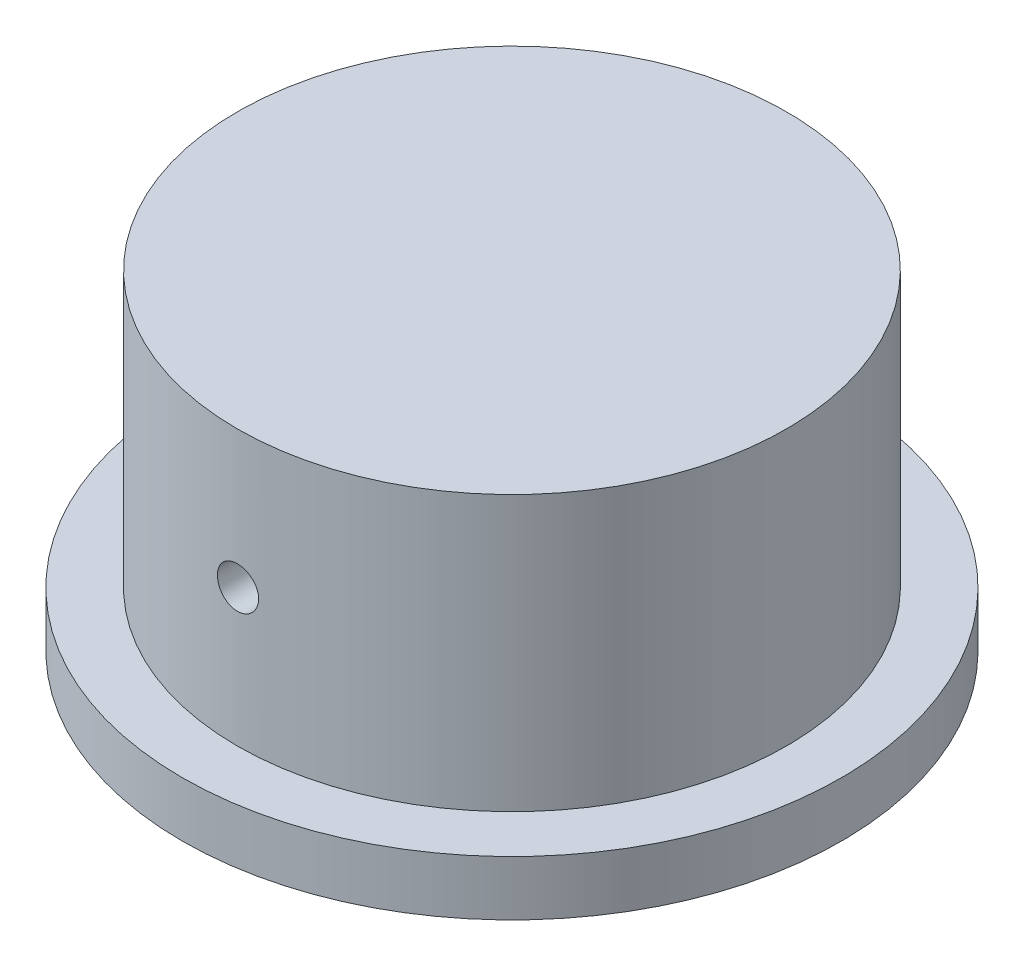
from build123d import *

# Parameters (mm, degrees)
SKETCH_1_R          = 12
EXTRUDE_1_DEPTH     = 2
SKETCH_2_R          = 10
EXTRUDE_2_DEPTH     = 10
SKETCH_3_R          = 0.75
CUT_EXTRUDE_1_DEPTH = 30


with BuildPart() as part:
    # 草图1 → 凸台-拉伸1 (new body)
    with BuildSketch(Plane(origin=(0, 0, 0), x_dir=(1, 0, 0), z_dir=(0, 1, 0))):
        with Locations(Location((0, 0, 0), (0, 0, 270))):
            Circle(SKETCH_1_R)
    extrude(amount=EXTRUDE_1_DEPTH)

    # 草图2 → 凸台-拉伸2 (add)
    with BuildSketch(Plane(origin=(0, 2, 0), x_dir=(1, 0, 0), z_dir=(0, 1, 0))):
        with Locations(Location((0, 0, 0), (0, 0, 270))):
            Circle(SKETCH_2_R)
    extrude(amount=EXTRUDE_2_DEPTH)

    # 草图3 → 切除-拉伸1 (cut, symmetric)
    with BuildSketch(Plane.XY):
        with Locations((0, 7)):
            Circle(SKETCH_3_R)
    extrude(amount=CUT_EXTRUDE_1_DEPTH, both=True, mode=Mode.SUBTRACT)


solid = part.part
